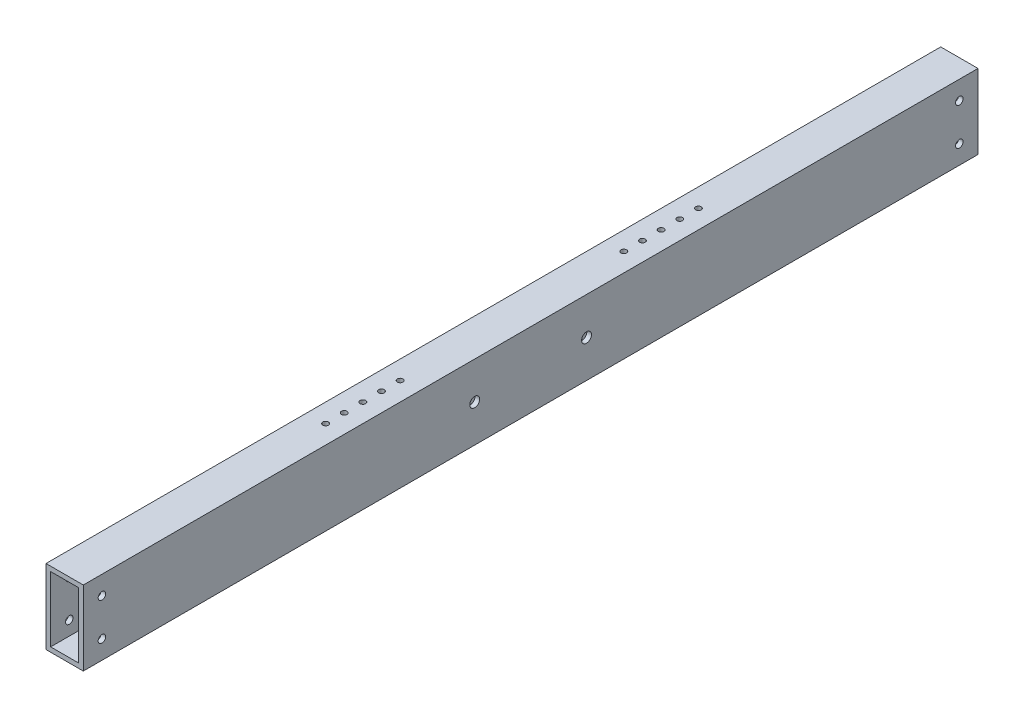
from build123d import *

# Parameters (mm, degrees)
SKETCH1_W               = 25.4
SKETCH1_H               = 50.8
SKETCH1_W_2             = 19.05
SKETCH1_H_2             = 44.45
BOSS_EXTRUDE1_DEPTH     = 304.8
F_10_CLEARANCE_HOLE1_D  = 5.1054
F_1_4_CLEARANCE_HOLE2_D = 6.7564
SKETCH7_R               = 1.905
CUT_EXTRUDE1_DEPTH      = 310.265209812


with BuildPart() as part:
    # Sketch1 → Boss-Extrude1 (new, symmetric)
    with BuildSketch(Plane.XY):
        Rectangle(SKETCH1_W, SKETCH1_H)
        Rectangle(SKETCH1_W_2, SKETCH1_H_2, mode=Mode.SUBTRACT)
    extrude(amount=BOSS_EXTRUDE1_DEPTH, both=True)

    # #10 Clearance Hole1 (through all)
    with Locations(Plane(origin=(12.7, 0, 0), x_dir=(0, 0, -1), z_dir=(1, 0, 0))):
        with Locations((-292.1, 12.7), (-292.1, -12.7)):
            f_10_clearance_hole1 = Hole(F_10_CLEARANCE_HOLE1_D / 2)

    # Mirror1: #10 Clearance Hole1 across plane
    add(f_10_clearance_hole1.mirror(Plane.XY), mode=Mode.SUBTRACT)

    # 1/4 Clearance Hole2 (through all)
    with Locations(Plane(origin=(12.7, 0, 0), x_dir=(0, 0, -1), z_dir=(1, 0, 0))):
        with Locations((-38.1, 0), (38.1, 0)):
            Hole(F_1_4_CLEARANCE_HOLE2_D / 2)

    # Sketch7 → Cut-Extrude1 (cut, through all)
    with BuildSketch(Plane(origin=(0, 25.4, 0), x_dir=(1, 0, 0), z_dir=(0, 1, 0))):
        with Locations(Location((0, 127, 0), (0, 0, 270))):
            Circle(SKETCH7_R)
        with Locations(Location((0, 114.3, 0), (0, 0, 270))):
            Circle(SKETCH7_R)
        with Locations(Location((0, 101.6, 0), (0, 0, 270))):
            Circle(SKETCH7_R)
        with Locations(Location((0, 88.9, 0), (0, 0, 270))):
            Circle(SKETCH7_R)
        with Locations(Location((0, 76.2, 0), (0, 0, 270))):
            Circle(SKETCH7_R)
    cut_extrude1 = extrude(amount=-CUT_EXTRUDE1_DEPTH, mode=Mode.SUBTRACT)

    # Mirror2: Cut-Extrude1 across plane
    add(cut_extrude1.mirror(Plane.XY), mode=Mode.SUBTRACT)


solid = part.part
